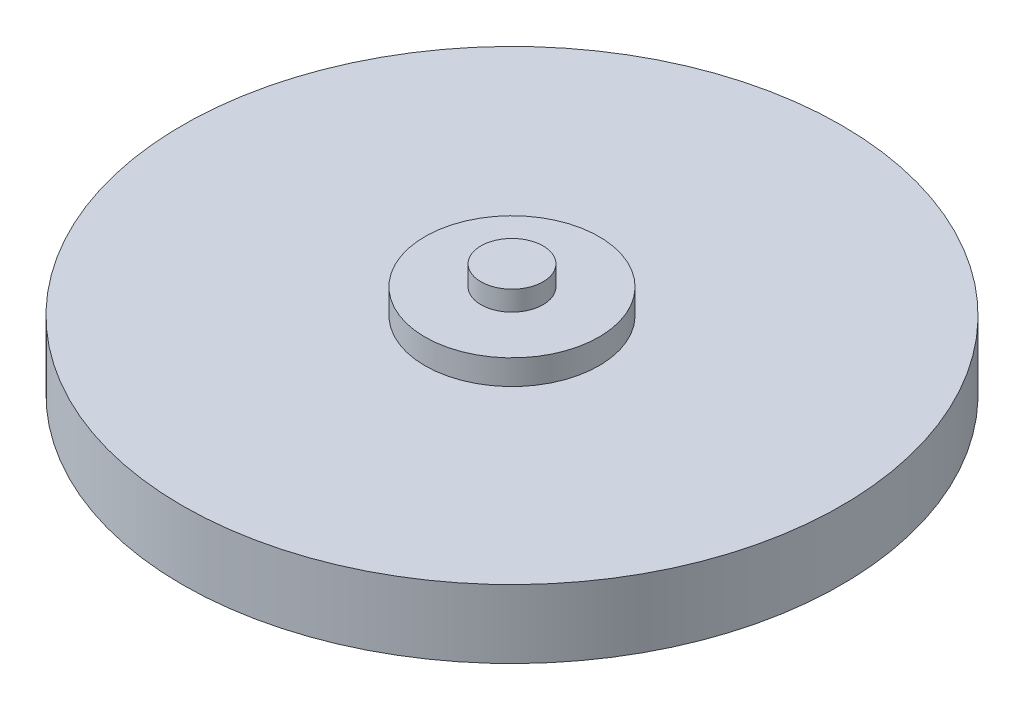
from build123d import *

# Parameters (mm, degrees)
SKETCH1_R           = 26.5
BOSS_EXTRUDE1_DEPTH = 3.5
SKETCH2_R           = 7
BOSS_EXTRUDE2_DEPTH = 2
SKETCH5_R           = 2.5
BOSS_EXTRUDE3_DEPTH = 1.6
BOSS_EXTRUDE4_START = 2
SKETCH6_R           = 26.5
SKETCH6_R_2         = 25
BOSS_EXTRUDE4_DEPTH = 2


with BuildPart() as part:
    # Sketch1 → Boss-Extrude1 (new body)
    with BuildSketch(Plane(origin=(0, 0, 0), x_dir=(1, 0, 0), z_dir=(0, 1, 0))):
        with Locations(Location((0, 0, 0), (0, 0, 270))):
            Circle(SKETCH1_R)
    extrude(amount=BOSS_EXTRUDE1_DEPTH)

    # Sketch2 → Boss-Extrude2 (add)
    with BuildSketch(Plane(origin=(0, 3.5, 0), x_dir=(1, 0, 0), z_dir=(0, 1, 0))):
        with Locations(Location((0, 0, 0), (0, 0, 270))):
            Circle(SKETCH2_R)
    extrude(amount=BOSS_EXTRUDE2_DEPTH)

    # Sketch5 → Boss-Extrude3 (add)
    with BuildSketch(Plane(origin=(0, 5.5, 0), x_dir=(1, 0, 0), z_dir=(0, 1, 0))):
        with Locations(Location((0, 0, 0), (0, 0, 270))):
            Circle(SKETCH5_R)
    extrude(amount=BOSS_EXTRUDE3_DEPTH)

    # Sketch6 → Boss-Extrude4 (add)
    with BuildSketch(Plane.XZ.offset(BOSS_EXTRUDE4_START)):
        with Locations(Location((0, 0, 0), (0, 0, 270))):
            Circle(SKETCH6_R)
        with Locations(Location((0, 0, 0), (0, 0, 270))):
            Circle(SKETCH6_R_2, mode=Mode.SUBTRACT)
    extrude(amount=-BOSS_EXTRUDE4_DEPTH)


solid = part.part
